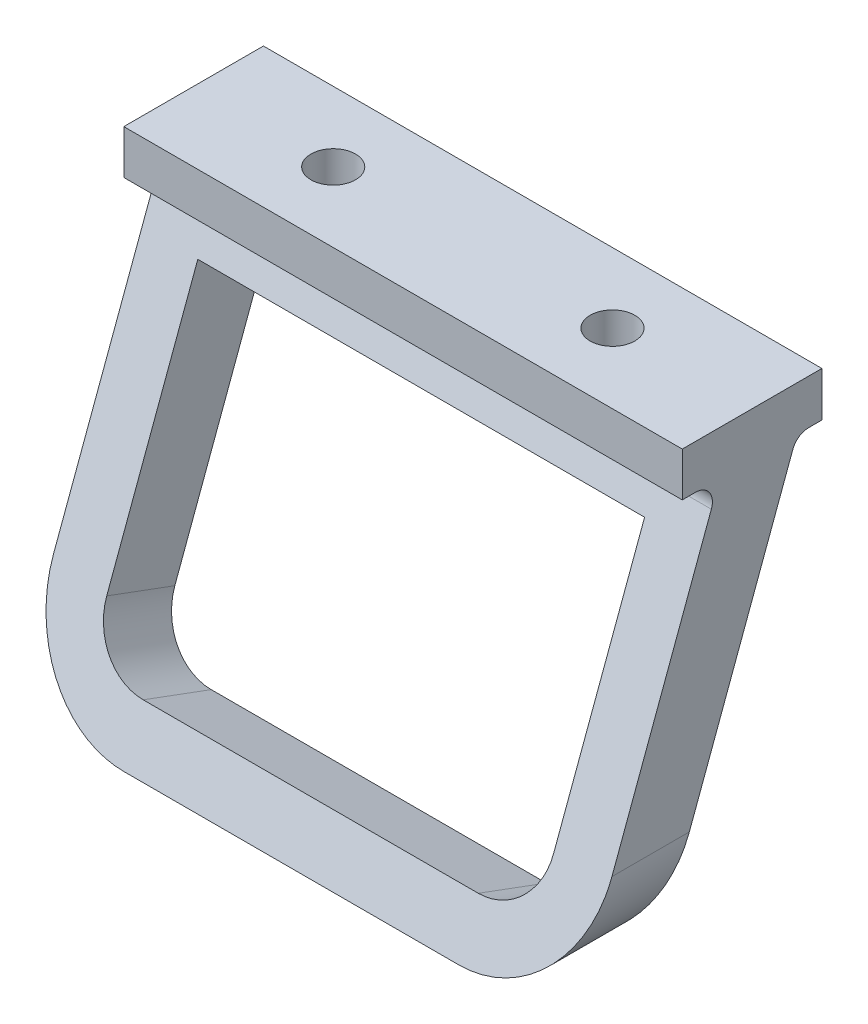
from build123d import *

# Parameters (mm, degrees)
BOSS_EXTRUDE1_DEPTH       = 100
FILLET1_R                 = 20
FILLET2_R                 = 20
CUT_EXTRUDE1_DEPTH        = 13
F_1_0MM_DOWEL_HOLE1_D     = 8
F_1_0MM_DOWEL_HOLE1_DEPTH = 12.596557524
F_1_0MM_DOWEL_HOLE1_TIP   = 2.403442476


with BuildPart() as part:
    # Sketch3 → Boss-Extrude1 (new body)
    with BuildSketch(Plane(origin=(0, 0, 0), x_dir=(0, 0, -1), z_dir=(1, 0, 0))):
        Polygon((24.06709422, 65), (0, 0), (13.862503416, 0), (37.929597637, 65), align=None)
        with BuildLine():
            Line((25.203655824, 68.069606309), (24.06709422, 65))
            Line((24.06709422, 65), (37.929597637, 65))
            Line((37.929597637, 65), (39.796344176, 70.041677401))
            ThreePointArc((39.796344176, 70.041677401), (40.895779886, 71.46221772), (42.609688839, 72))
            Line((42.609688839, 72), (45, 72))
            Line((45, 72), (45, 80))
            Line((45, 80), (20, 80))
            Line((20, 80), (20, 72.11128371))
            Line((20, 72.11128371), (22.390311161, 72.11128371))
            ThreePointArc((22.390311161, 72.11128371), (24.852528882, 70.825192663), (25.203655824, 68.069606309))
        make_face()
    extrude(amount=BOSS_EXTRUDE1_DEPTH)

    # Fillet1
    fillet1_edges = [part.edges().sort_by_distance(p)[0] for p in [
        (100, 0, -6.931251708),
    ]]
    fillet(fillet1_edges, radius=FILLET1_R)

    # Fillet2
    fillet2_edges = [part.edges().sort_by_distance(p)[0] for p in [
        (0, 0, -6.931251708),
    ]]
    fillet(fillet2_edges, radius=FILLET2_R)

    # Sketch4 → Cut-Extrude1 (cut)
    with BuildSketch(Plane(origin=(0, 0, 0), x_dir=(1, 0, 0), z_dir=(0, 0.34722580038254636, 0.9377815542804733))):
        with BuildLine():
            Line((10, 66.96704035), (10, 20))
            ThreePointArc((10, 20), (12.928932188, 12.928932188), (20, 10))
            Line((20, 10), (80, 10))
            ThreePointArc((80, 10), (87.071067812, 12.928932188), (90, 20))
            Line((90, 20), (90, 66.96704035))
            Line((90, 66.96704035), (10, 66.96704035))
        make_face()
    extrude(amount=-CUT_EXTRUDE1_DEPTH, mode=Mode.SUBTRACT)

    # Ø1.0mm Dowel Hole1
    with Locations(Plane(origin=(0, 80, 0), x_dir=(1, 0, 0), z_dir=(0, 1, 0))):
        with Locations((25, 32.5), (75, 32.5)):
            Hole(F_1_0MM_DOWEL_HOLE1_D / 2, depth=F_1_0MM_DOWEL_HOLE1_DEPTH)
            with Locations((0, 0, -(F_1_0MM_DOWEL_HOLE1_DEPTH + F_1_0MM_DOWEL_HOLE1_TIP / 2))):  # 118° drill point
                Cone(0, F_1_0MM_DOWEL_HOLE1_D / 2, F_1_0MM_DOWEL_HOLE1_TIP, mode=Mode.SUBTRACT)


solid = part.part
